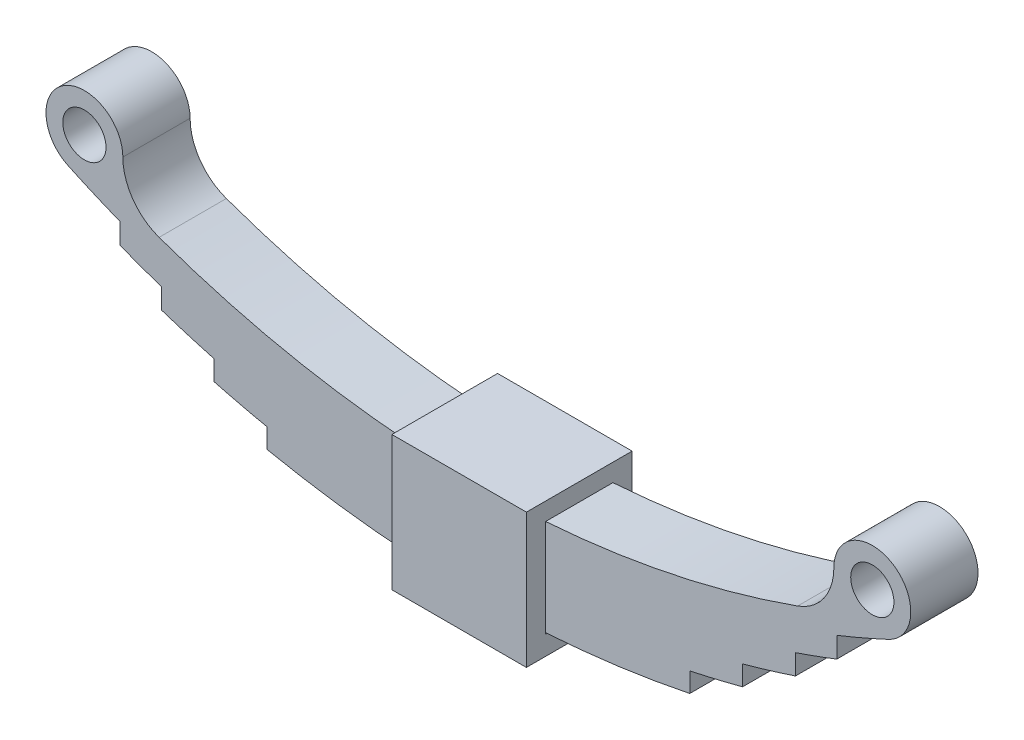
from build123d import *

# Parameters (mm, degrees)
SKETCH1_R           = 2.25
BOSS_EXTRUDE2_DEPTH = 7
SKETCH4_W           = 11
SKETCH4_H           = 14
SKETCH4_W_2         = 7
SKETCH4_H_2         = 10
BOSS_EXTRUDE3_DEPTH = 7
SKETCH5_R           = 4
CUT_EXTRUDE1_DEPTH  = 11


with BuildPart() as part:
    # Sketch1 → Boss-Extrude2 (new body)
    with BuildSketch(Plane.XY):
        with BuildLine():
            Line((0, -11.090956097), (0, -13.090956097))
            Line((0, -13.090956097), (0, -15.090956097))
            Line((0, -15.090956097), (0, -17.090956097))
            Line((0, -17.090956097), (0, -19.090956097))
            Line((0, -19.090956097), (0, -21.090956097))
            ThreePointArc((0, -21.090956097), (-11.05703676, -20.528689096), (-22, -18.847688905))
            Line((-22, -18.847688905), (-22, -16.804852023))
            ThreePointArc((-22, -16.804852023), (-24.758641092, -16.187112084), (-27.5, -15.496710289))
            Line((-27.5, -15.496710289), (-27.5, -13.425797094))
            ThreePointArc((-27.5, -13.425797094), (-30.261321018, -12.635734431), (-33, -11.770442452))
            Line((-33, -11.770442452), (-33, -9.661443438))
            ThreePointArc((-33, -9.661443438), (-35.158670825, -8.904528832), (-37.3, -8.099861934))
            Line((-37.3, -8.099861934), (-37.3, -5.951011498))
            ThreePointArc((-37.3, -5.951011498), (-40.012264818, -4.827241682), (-42.690721649, -3.625115213))
            ThreePointArc((-42.690721649, -3.625115213), (-43.149082758, 3.373639474), (-37, 0))
            ThreePointArc((-37, 0), (-35.962178278, -3.272189532), (-33.228136882, -5.348078717))
            ThreePointArc((-33.228136882, -5.348078717), (-16.860380491, -9.644672426), (0, -11.090956097))
        make_face()
        with Locations((-41, 0)):
            Circle(SKETCH1_R, mode=Mode.SUBTRACT)
    extrude(amount=BOSS_EXTRUDE2_DEPTH)

    # Mirror1: part across plane


with BuildPart() as part_1:
    add(part.part)
    add(part.part.mirror(Plane(origin=(0, -11.090956097, 7), x_dir=(0, 0, 1), z_dir=(1, 0, 0))))

    # Sketch4 → Boss-Extrude3 (add, symmetric)
    with BuildSketch(Plane(origin=(0, 0, 0), x_dir=(0, 0, -1), z_dir=(1, 0, 0))):
        with Locations((-3.5, -16)):
            Rectangle(SKETCH4_W, SKETCH4_H)
        with Locations((-3.5, -16)):
            Rectangle(SKETCH4_W_2, SKETCH4_H_2, mode=Mode.SUBTRACT)
    extrude(amount=BOSS_EXTRUDE3_DEPTH, both=True)

    # Sketch5 → Cut-Extrude1 (cut)
    with BuildSketch(Plane.XZ.offset(23)):
        with Locations(Location((0, 3.5, 0), (0, 0, 270))):
            Circle(SKETCH5_R)
    extrude(amount=-CUT_EXTRUDE1_DEPTH, mode=Mode.SUBTRACT)


solid = part_1.part
